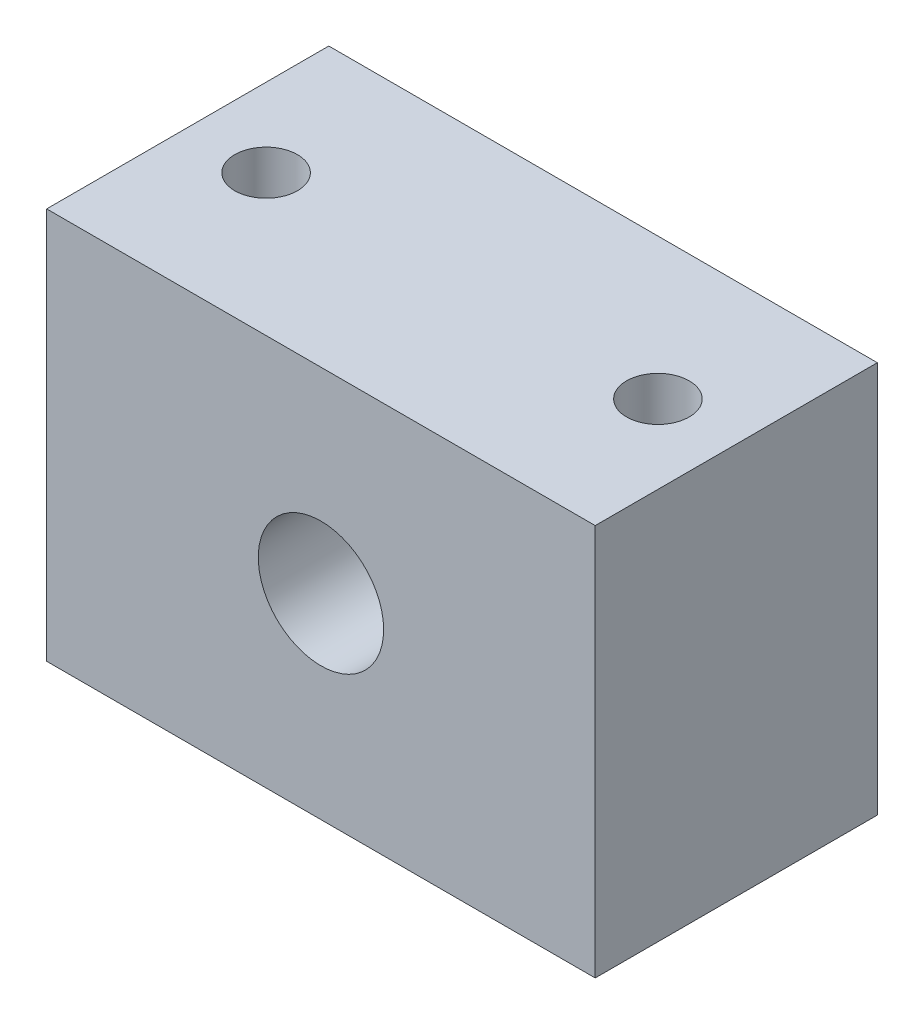
from build123d import *

# Parameters (mm, degrees)
SKETCH1_W           = 35
SKETCH1_H           = 25
SKETCH1_R           = 4
BOSS_EXTRUDE1_DEPTH = 18
SKETCH3_R           = 2
CUT_EXTRUDE1_DEPTH  = 36.429507476


with BuildPart() as part:
    # Sketch1 → Boss-Extrude1 (new body)
    with BuildSketch(Plane.XY):
        Rectangle(SKETCH1_W, SKETCH1_H)
        Circle(SKETCH1_R, mode=Mode.SUBTRACT)
    extrude(amount=BOSS_EXTRUDE1_DEPTH)

    # Sketch3 → Cut-Extrude1 (cut, through all)
    with BuildSketch(Plane(origin=(0, 12.5, 0), x_dir=(1, 0, 0), z_dir=(0, 1, 0))):
        with Locations(Location((-12.5, -9, 0), (0, 0, 270))):
            Circle(SKETCH3_R)
        with Locations(Location((12.5, -9, 0), (0, 0, 90))):
            Circle(SKETCH3_R)
    extrude(amount=-CUT_EXTRUDE1_DEPTH, mode=Mode.SUBTRACT)


solid = part.part
